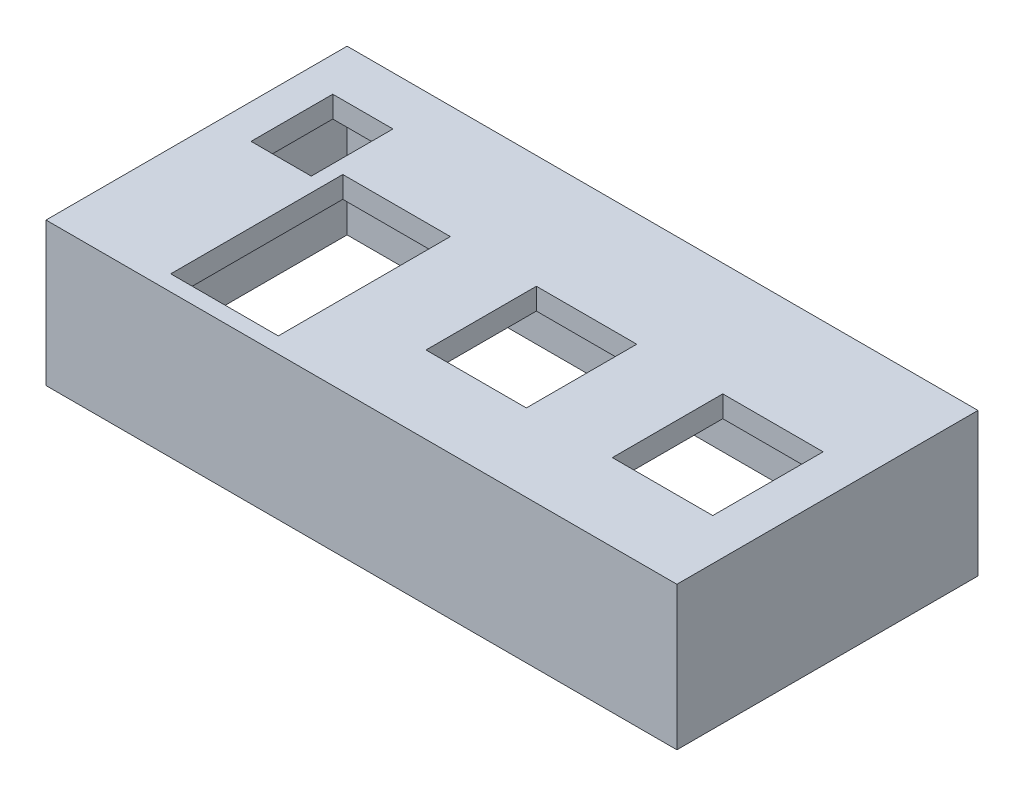
from build123d import *

# Parameters (mm, degrees)
ESQUISSE1_W             = 88
ESQUISSE1_H             = 42
BOSS_EXTRU_1_DEPTH      = 20
ESQUISSE2_W             = 82.4
ESQUISSE2_H             = 36.4
ENL_V_MAT_EXTRU_1_DEPTH = 17
ESQUISSE3_W             = 14
ESQUISSE3_H             = 15.4
ESQUISSE3_W_2           = 15
ESQUISSE3_H_2           = 24
ESQUISSE3_W_3           = 8.4
ESQUISSE3_H_3           = 11.4
ENL_V_MAT_EXTRU_3_DEPTH = 53


with BuildPart() as part:
    # Esquisse1 → Boss.-Extru.1 (new body)
    with BuildSketch(Plane(origin=(0, 0, 0), x_dir=(1, 0, 0), z_dir=(0, 1, 0))):
        with Locations((-25.603062664, -21.590445487)):
            Rectangle(ESQUISSE1_W, ESQUISSE1_H)
    extrude(amount=BOSS_EXTRU_1_DEPTH)

    # Esquisse2 → Enlèv. mat.-Extru.1 (cut)
    with BuildSketch(Plane(origin=(0, 0, 0), x_dir=(1, 0, 0), z_dir=(0, 1, 0))):
        with Locations((-25.603062664, -21.590445487)):
            Rectangle(ESQUISSE2_W, ESQUISSE2_H)
    extrude(amount=ENL_V_MAT_EXTRU_1_DEPTH, mode=Mode.SUBTRACT)

    # Esquisse3 → Enlèv. mat.-Extru.3 (cut)
    with BuildSketch(Plane(origin=(0, 0, 0), x_dir=(1, 0, 0), z_dir=(0, 1, 0))):
        with Locations((5.596937336, -24.090445487)):
            Rectangle(ESQUISSE3_W, ESQUISSE3_H)
        with Locations((-20.403062664, -24.090445487)):
            Rectangle(ESQUISSE3_W, ESQUISSE3_H)
        with Locations((-46.903062664, -28.390445487)):
            Rectangle(ESQUISSE3_W_2, ESQUISSE3_H_2)
        with Locations((-60.603062664, -13.090445487)):
            Rectangle(ESQUISSE3_W_3, ESQUISSE3_H_3)
    extrude(amount=ENL_V_MAT_EXTRU_3_DEPTH, mode=Mode.SUBTRACT)


solid = part.part
